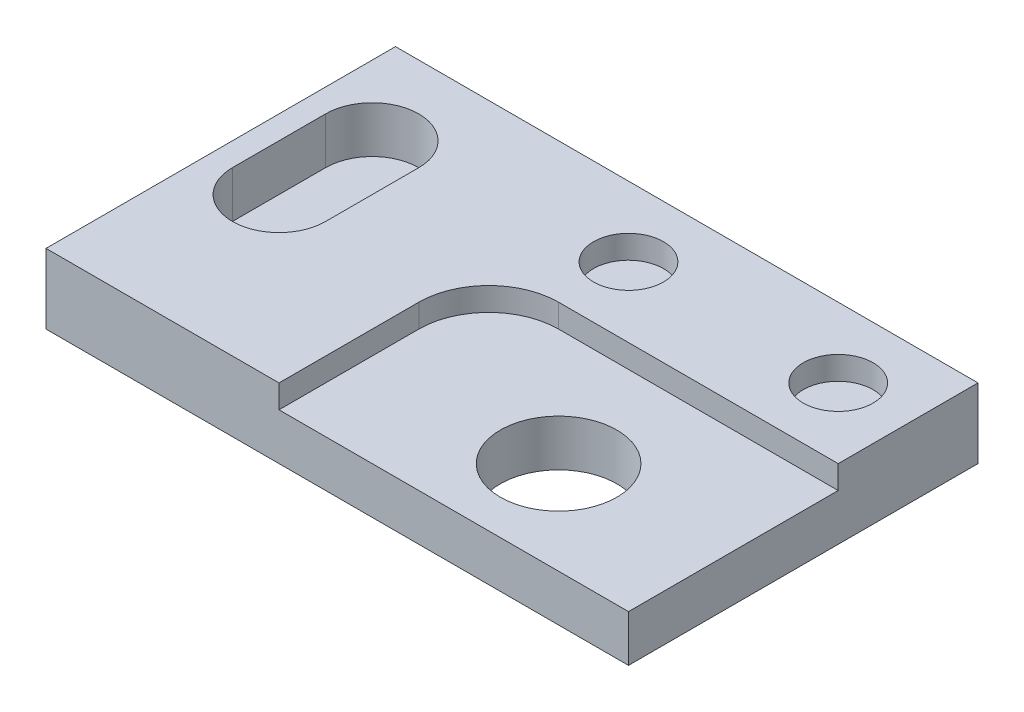
from build123d import *

# Parameters (mm, degrees)
SKETCH2_W           = 250
SKETCH2_H           = 150
BOSS_EXTRUDE1_DEPTH = 30
CUT_EXTRUDE2_DEPTH  = 20
SKETCH3_5_R         = 15
CUT_EXTRUDE3_DEPTH  = 10
SKETCH3_6_R         = 25
CUT_EXTRUDE4_DEPTH  = 149.828760661
SKETCH3_7_R         = 25
CUT_EXTRUDE5_DEPTH  = 10


with BuildPart() as part:
    # Sketch2 → Boss-Extrude1 (new body)
    with BuildSketch(Plane(origin=(0, 0, 0), x_dir=(1, 0, 0), z_dir=(0, 1, 0))):
        Rectangle(SKETCH2_W, SKETCH2_H)
    extrude(amount=-BOSS_EXTRUDE1_DEPTH)

    # Sketch3 → Cut-Extrude2 (cut)
    with BuildSketch(Plane(origin=(0, 0, 0), x_dir=(1, 0, 0), z_dir=(0, 1, 0))):
        with BuildLine():
            Line((-75, -5), (-75, 35))
            ThreePointArc((-75, 35), (-95, 55), (-115, 35))
            Line((-115, 35), (-115, -5))
            ThreePointArc((-115, -5), (-95, -25), (-75, -5))
        make_face()
    extrude(amount=-CUT_EXTRUDE2_DEPTH, mode=Mode.SUBTRACT)

    # Sketch3<5> → Cut-Extrude3 (cut)
    with BuildSketch(Plane(origin=(0, 0, 0), x_dir=(1, 0, 0), z_dir=(0, 1, 0))):
        with Locations((5, 45)):
            Circle(SKETCH3_5_R)
        with Locations((95, 45)):
            Circle(SKETCH3_5_R)
    extrude(amount=-CUT_EXTRUDE3_DEPTH, mode=Mode.SUBTRACT)

    # Sketch3<6> → Cut-Extrude4 (cut, through all)
    with BuildSketch(Plane(origin=(0, 0, 0), x_dir=(1, 0, 0), z_dir=(0, 1, 0))):
        with Locations((55, -35)):
            Circle(SKETCH3_6_R)
    extrude(amount=-CUT_EXTRUDE4_DEPTH, mode=Mode.SUBTRACT)

    # Sketch3<7> → Cut-Extrude5 (cut)
    with BuildSketch(Plane(origin=(0, 0, 0), x_dir=(1, 0, 0), z_dir=(0, 1, 0))):
        with BuildLine():
            Line((-25, -75), (125, -75))
            Line((125, -75), (125, 15))
            Line((125, 15), (5, 15))
            ThreePointArc((5, 15), (-16.213203436, 6.213203436), (-25, -15))
            Line((-25, -15), (-25, -75))
        make_face()
        with Locations((55, -35)):
            Circle(SKETCH3_7_R, mode=Mode.SUBTRACT)
    extrude(amount=-CUT_EXTRUDE5_DEPTH, mode=Mode.SUBTRACT)


solid = part.part
